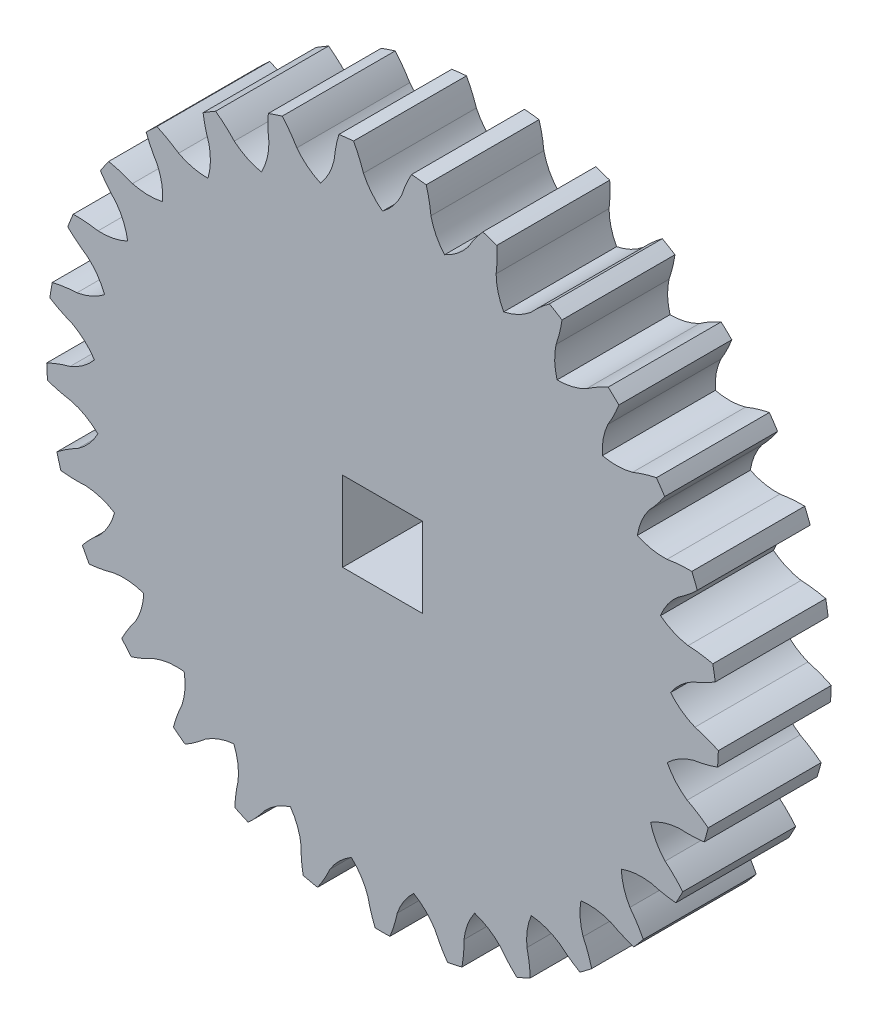
from build123d import *

# Parameters (mm, degrees)
SKETCH1_R           = 29.75
SKETCH1_W           = 7.071067812
SKETCH1_H           = 7.071067812
BOSS_EXTRUDE1_DEPTH = 10
CUT_EXTRUDE1_DEPTH  = 44.244941901
CIRPATTERN1_COUNT   = 29


with BuildPart() as part:
    # Sketch1 → Boss-Extrude1 (new body)
    with BuildSketch(Plane.XY):
        Circle(SKETCH1_R)
        Rectangle(SKETCH1_W, SKETCH1_H, mode=Mode.SUBTRACT)
    extrude(amount=BOSS_EXTRUDE1_DEPTH)

    # Sketch2 → Cut-Extrude1 (cut, through all)
    with BuildSketch(Plane.XY):
        with BuildLine():
            ThreePointArc((0, 25.543580948), (-0.974317868, 26.472596764), (-1.690877269, 27.612293356))
            ThreePointArc((-1.690877269, 27.612293356), (-3.707498788, 31.338974425), (-6.921804626, 34.099980061))
            ThreePointArc((-6.921804626, 34.099980061), (-3.661433163, 35.923952851), (0, 36.666115912))
            ThreePointArc((0, 36.666115912), (3.661433163, 35.923952851), (6.921804626, 34.099980061))
            ThreePointArc((6.921804626, 34.099980061), (3.707498788, 31.338974425), (1.690877269, 27.612293356))
            ThreePointArc((1.690877269, 27.612293356), (0.974317868, 26.472596764), (0, 25.543580948))
        make_face()
    cut_extrude1 = extrude(amount=CUT_EXTRUDE1_DEPTH, mode=Mode.SUBTRACT)

    # CirPattern1: Cut-Extrude1 ×29 about axis
    cirpattern1_axis = Axis((0, 0, 0), (0, 0, 1))
    for i in range(1, CIRPATTERN1_COUNT):
        add(cut_extrude1.rotate(cirpattern1_axis, i * 360 / CIRPATTERN1_COUNT), mode=Mode.SUBTRACT)


solid = part.part
